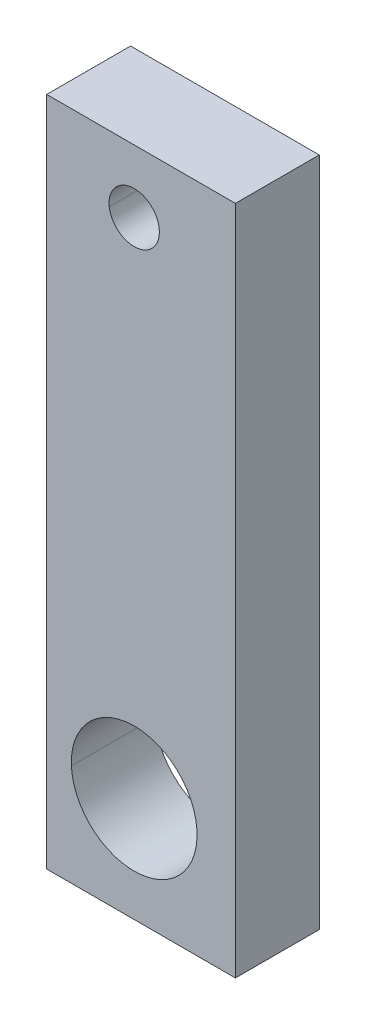
from build123d import *

# Parameters (mm, degrees)
SZKIC1_W                    = 45
SZKIC1_H                    = 160
SZKIC1_R                    = 6
SZKIC1_R_2                  = 15
DODANIE_WYCI_GNI_CIE1_DEPTH = 20


with BuildPart() as part:
    # Szkic1 → Dodanie-wyciągnięcie1 (new body)
    with BuildSketch(Plane.XY):
        with Locations((22.5, -80)):
            Rectangle(SZKIC1_W, SZKIC1_H)
        with Locations((20.862115209, -15)):
            Circle(SZKIC1_R, mode=Mode.SUBTRACT)
        with Locations((20.862115209, -135)):
            Circle(SZKIC1_R_2, mode=Mode.SUBTRACT)
    extrude(amount=DODANIE_WYCI_GNI_CIE1_DEPTH)


solid = part.part
